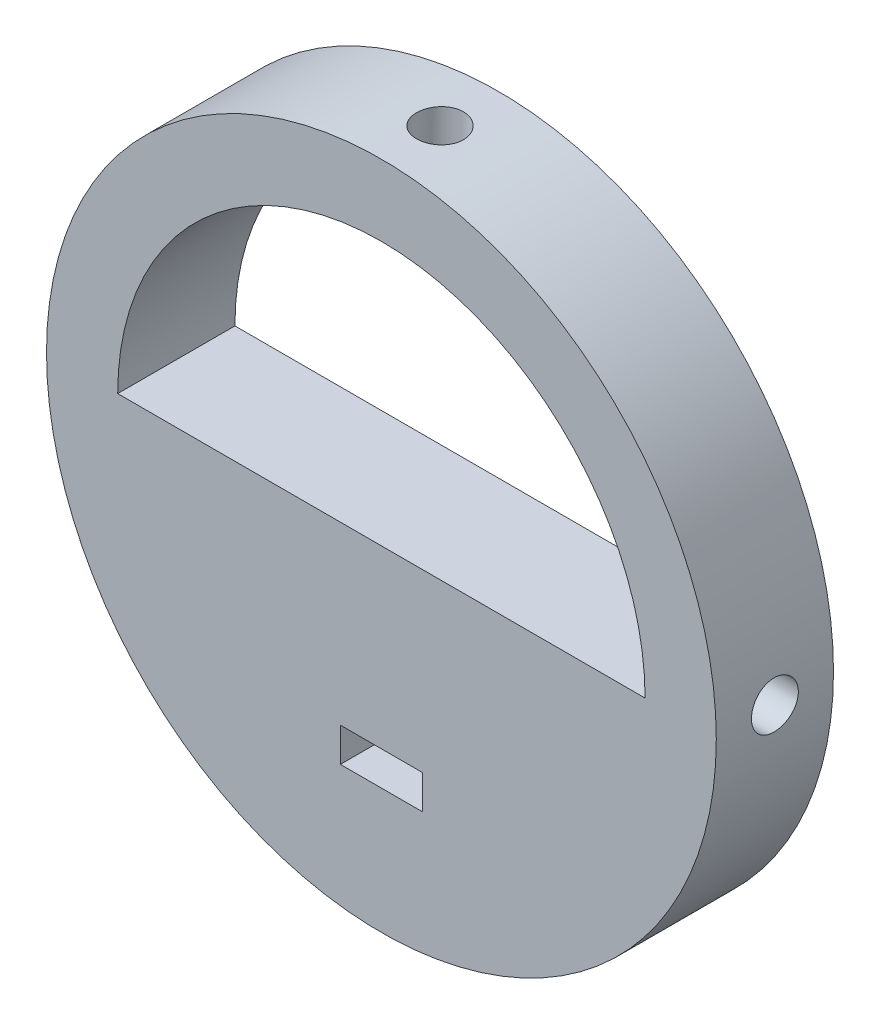
from build123d import *

# Parameters (mm, degrees)
BOSS_EXTRUDE1_DEPTH      = 5
BOSS_EXTRUDE1_DEPTH_BACK = 5
SKETCH1_R                = 28.575
CUT_EXTRUDE12_START      = 29
SKETCH15_R               = 2
CUT_EXTRUDE12_DEPTH      = 5
CUT_EXTRUDE13_START      = -29
SKETCH16_R               = 2
CUT_EXTRUDE13_DEPTH      = 5
CUT_EXTRUDE14_START      = -15
CUT_EXTRUDE14_DEPTH      = 2.9
CUT_EXTRUDE15_DEPTH      = 41.719298408
CUT_EXTRUDE15_DEPTH_BACK = 41.719298408
SKETCH21_W               = 7
SKETCH21_H               = 2.9
CUT_EXTRUDE16_DEPTH      = 5
SKETCH22_R               = 2
CUT_EXTRUDE17_DEPTH      = 55.785547971


with BuildPart() as part:
    # Sketch1 → Boss-Extrude1 (new, two sides: drawn at the far end of the back side and taken through both)
    with BuildSketch(Plane.XY.offset(-BOSS_EXTRUDE1_DEPTH_BACK)):
        Circle(SKETCH1_R)
    extrude(amount=BOSS_EXTRUDE1_DEPTH + BOSS_EXTRUDE1_DEPTH_BACK)

    # Sketch15 → Cut-Extrude12 (cut)
    with BuildSketch(Plane(origin=(0, 0, 0), x_dir=(1, 0, 0), z_dir=(0, 1, 0)).offset(CUT_EXTRUDE12_START)):
        Circle(SKETCH15_R)
    extrude(amount=-CUT_EXTRUDE12_DEPTH, mode=Mode.SUBTRACT)

    # Sketch16 → Cut-Extrude13 (cut)
    with BuildSketch(Plane(origin=(0, 0, 0), x_dir=(0, 0, -1), z_dir=(1, 0, 0)).offset(CUT_EXTRUDE13_START)):
        Circle(SKETCH16_R)
    cut_extrude13 = extrude(amount=CUT_EXTRUDE13_DEPTH, mode=Mode.SUBTRACT)

    # Sketch19 → Cut-Extrude14 (cut)
    with BuildSketch(Plane(origin=(0, 0, 0), x_dir=(1, 0, 0), z_dir=(0, 1, 0)).offset(CUT_EXTRUDE14_START)):
        Polygon((0, 4.041451884), (-3.5, 2.020725942), (-3.5, -2.020725942), (0, -4.041451884), (3.5, -2.020725942), (3.5, 2.020725942), align=None)
    extrude(amount=-CUT_EXTRUDE14_DEPTH, mode=Mode.SUBTRACT)

    # Sketch20 → Cut-Extrude15 (cut, two sides: drawn at the far end of the back side and taken through both)
    with BuildSketch(Plane.XY.offset(-CUT_EXTRUDE15_DEPTH_BACK)):
        with BuildLine():
            Line((-22.5, 0), (22.5, 0))
            ThreePointArc((22.5, 0), (0, 22.5), (-22.5, 0))
        make_face()
    extrude(amount=CUT_EXTRUDE15_DEPTH + CUT_EXTRUDE15_DEPTH_BACK, mode=Mode.SUBTRACT)

    # Mirror1: Cut-Extrude13 across plane
    add(cut_extrude13.mirror(Plane(origin=(0, 0, 0), x_dir=(0, 0, 1), z_dir=(1, 0, 0))), mode=Mode.SUBTRACT)

    # Sketch21 → Cut-Extrude16 (cut)
    with BuildSketch(Plane.XY.offset(5)):
        with Locations((0, -16.45)):
            Rectangle(SKETCH21_W, SKETCH21_H)
    extrude(amount=-CUT_EXTRUDE16_DEPTH, mode=Mode.SUBTRACT)

    # Sketch22 → Cut-Extrude17 (cut, through all)
    with BuildSketch(Plane(origin=(0, -17.9, 0), x_dir=(1, 0, 0), z_dir=(0, 1, 0))):
        Circle(SKETCH22_R)
    extrude(amount=-CUT_EXTRUDE17_DEPTH, mode=Mode.SUBTRACT)


solid = part.part
